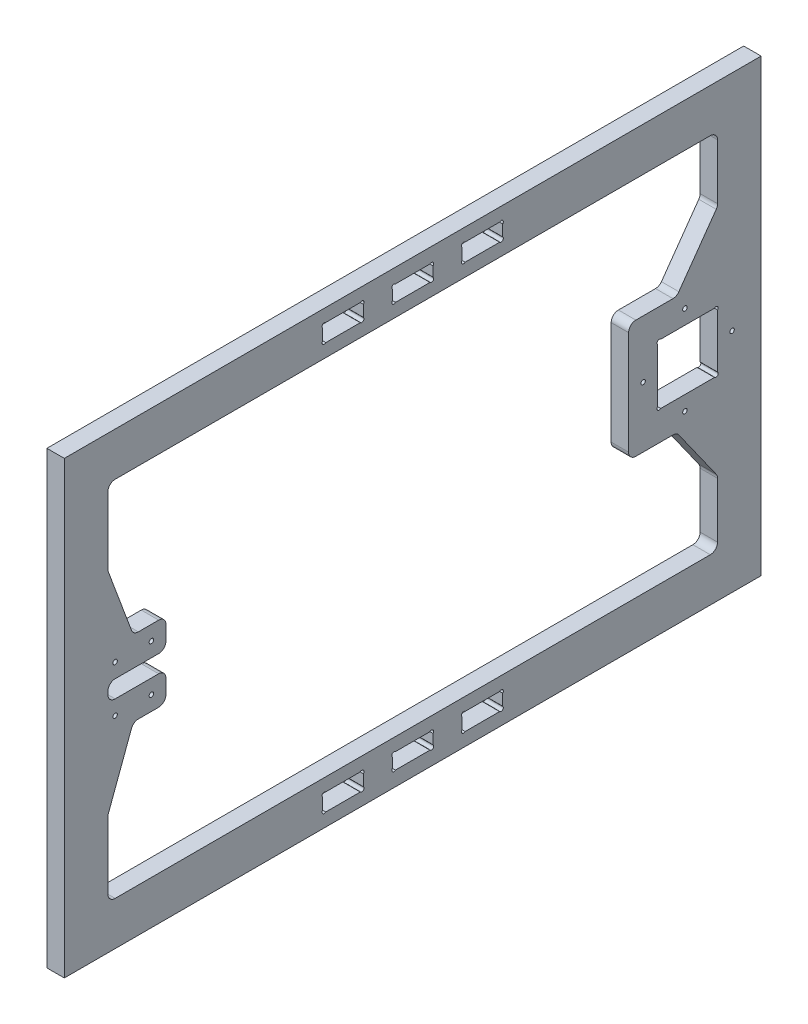
from build123d import *

# Parameters (mm, degrees)
CROQUIS1_W              = 480
CROQUIS1_H              = 310
CROQUIS1_W_2            = 28
CROQUIS1_H_2            = 12
CROQUIS1_H_3            = 11
CROQUIS1_W_3            = 41.3
CROQUIS1_H_4            = 41.3
SALIENTE_EXTRUIR1_DEPTH = 12
SKETCH1_R               = 1.5
CUT_EXTRUDE1_DEPTH      = 572.527777103
SKETCH2_R               = 1.55
CUT_EXTRUDE2_DEPTH      = 12
FILLET1_R               = 5
SKETCH3_R               = 1.55
CUT_EXTRUDE3_DEPTH      = 12
BOSS_EXTRUDE1_DEPTH     = 12
FILLET2_R               = 5


with BuildPart() as part:
    # Croquis1 → Saliente-Extruir1 (new body)
    with BuildSketch(Plane(origin=(0, 0, 0), x_dir=(0, 0, -1), z_dir=(1, 0, 0))):
        with Locations((240, -155)):
            Rectangle(CROQUIS1_W, CROQUIS1_H)
        Polygon((30, -30), (450, -30), (450, -114.35), (388.7, -114.35), (388.7, -195.65), (450, -195.65), (450, -280), (30, -280), (30, -181), (70, -181), (70, -161), (30, -161), (30, -149), (70, -149), (70, -129), (30, -129), align=None, mode=Mode.SUBTRACT)
        with Locations((288, -295)):
            Rectangle(CROQUIS1_W_2, CROQUIS1_H_2, mode=Mode.SUBTRACT)
        with Locations((240, -294.5)):
            Rectangle(CROQUIS1_W_2, CROQUIS1_H_3, mode=Mode.SUBTRACT)
        with Locations((192, -295)):
            Rectangle(CROQUIS1_W_2, CROQUIS1_H_2, mode=Mode.SUBTRACT)
        with Locations((192, -15)):
            Rectangle(CROQUIS1_W_2, CROQUIS1_H_2, mode=Mode.SUBTRACT)
        with Locations((288, -15)):
            Rectangle(CROQUIS1_W_2, CROQUIS1_H_2, mode=Mode.SUBTRACT)
        with Locations((240, -15.5)):
            Rectangle(CROQUIS1_W_2, CROQUIS1_H_3, mode=Mode.SUBTRACT)
        with Locations((429.35, -155)):
            Rectangle(CROQUIS1_W_3, CROQUIS1_H_4, mode=Mode.SUBTRACT)
    extrude(amount=SALIENTE_EXTRUIR1_DEPTH)

    # Sketch1 → Cut-Extrude1 (cut, through all)
    with BuildSketch(Plane(origin=(12, 0, 0), x_dir=(0, 0, -1), z_dir=(1, 0, 0))):
        with Locations((204.939339828, -10.060660172)):
            Circle(SKETCH1_R)
        with Locations((179.060660172, -10.060660172)):
            Circle(SKETCH1_R)
        with Locations((227.060660172, -11.060660172)):
            Circle(SKETCH1_R)
        with Locations((227.060660172, -19.939339828)):
            Circle(SKETCH1_R)
        with Locations((252.939339828, -11.060660172)):
            Circle(SKETCH1_R)
        with Locations((252.939339828, -19.939339828)):
            Circle(SKETCH1_R)
        with Locations((275.060660172, -10.060660172)):
            Circle(SKETCH1_R)
        with Locations((275.060660172, -19.939339828)):
            Circle(SKETCH1_R)
        with Locations((300.939339828, -19.939339828)):
            Circle(SKETCH1_R)
        with Locations((300.939339828, -10.060660172)):
            Circle(SKETCH1_R)
        with Locations((409.760660172, -135.410660172)):
            Circle(SKETCH1_R)
        with Locations((448.939339828, -135.410660172)):
            Circle(SKETCH1_R)
        with Locations((448.939339828, -174.589339828)):
            Circle(SKETCH1_R)
        with Locations((409.760660172, -174.589339828)):
            Circle(SKETCH1_R)
        with Locations((179.060660172, -19.939339828)):
            Circle(SKETCH1_R)
        with Locations((204.939339828, -19.939339828)):
            Circle(SKETCH1_R)
        with Locations((204.939339828, -290.060660172)):
            Circle(SKETCH1_R)
        with Locations((179.060660172, -290.060660172)):
            Circle(SKETCH1_R)
        with Locations((300.939339828, -299.939339828)):
            Circle(SKETCH1_R)
        with Locations((300.939339828, -290.060660172)):
            Circle(SKETCH1_R)
        with Locations((275.060660172, -290.060660172)):
            Circle(SKETCH1_R)
        with Locations((275.060660172, -299.939339828)):
            Circle(SKETCH1_R)
        with Locations((252.939339828, -290.060660172)):
            Circle(SKETCH1_R)
        with Locations((252.939339828, -298.939339828)):
            Circle(SKETCH1_R)
        with Locations((227.060660172, -290.060660172)):
            Circle(SKETCH1_R)
        with Locations((227.060660172, -298.939339828)):
            Circle(SKETCH1_R)
        with Locations((179.060660172, -299.939339828)):
            Circle(SKETCH1_R)
        with Locations((204.939339828, -299.939339828)):
            Circle(SKETCH1_R)
    extrude(amount=-CUT_EXTRUDE1_DEPTH, mode=Mode.SUBTRACT)

    # Sketch2 → Cut-Extrude2 (cut)
    with BuildSketch(Plane(origin=(12, 0, 0), x_dir=(0, 0, -1), z_dir=(1, 0, 0))):
        with Locations((60, -171)):
            Circle(SKETCH2_R)
        with Locations((35, -171)):
            Circle(SKETCH2_R)
        with Locations((35, -139)):
            Circle(SKETCH2_R)
        with Locations((60, -139)):
            Circle(SKETCH2_R)
    extrude(amount=-CUT_EXTRUDE2_DEPTH, mode=Mode.SUBTRACT)

    # Fillet1
    fillet1_edges = [part.edges().sort_by_distance(p)[0] for p in [
        (6, -30, -30),
        (6, -129, -70),
        (6, -149, -70),
        (6, -149, -30),
        (6, -161, -30),
        (6, -161, -70),
        (6, -181, -70),
        (6, -280, -30),
        (6, -280, -450),
        (6, -195.65, -388.7),
        (6, -114.35, -388.7),
        (6, -30, -450),
    ]]
    fillet(fillet1_edges, radius=FILLET1_R)

    # Sketch3 → Cut-Extrude3 (cut)
    with BuildSketch(Plane(origin=(12, 0, 0), x_dir=(0, 0, -1), z_dir=(1, 0, 0))):
        with Locations((427.52464912, -185.65)):
            Circle(SKETCH3_R)
        with Locations((460, -153.912701142)):
            Circle(SKETCH3_R)
        with Locations((427.52464912, -124.35)):
            Circle(SKETCH3_R)
        with Locations((398.7, -153.912701142)):
            Circle(SKETCH3_R)
    extrude(amount=-CUT_EXTRUDE3_DEPTH, mode=Mode.SUBTRACT)

    # Sketch4 → Boss-Extrude1 (add)
    with BuildSketch(Plane(origin=(12, 0, 0), x_dir=(0, 0, -1), z_dir=(1, 0, 0))):
        Polygon((421.85, -114.35), (450, -74.675), (450, -114.35), align=None)
        Polygon((421.85, -195.65), (450, -235.325), (450, -195.65), align=None)
        Polygon((47.5, -129), (30, -82), (30, -129), align=None)
        Polygon((47.5, -181), (30, -228), (30, -181), align=None)
    extrude(amount=-BOSS_EXTRUDE1_DEPTH)

    # Fillet2
    fillet2_edges = [part.edges().sort_by_distance(p)[0] for p in [
        (6, -114.35, -421.85),
        (6, -74.675, -450),
        (6, -195.65, -421.85),
        (6, -235.325, -450),
        (6, -129, -47.5),
        (6, -82, -30),
        (6, -181, -47.5),
        (6, -228, -30),
    ]]
    fillet(fillet2_edges, radius=FILLET2_R)


solid = part.part
